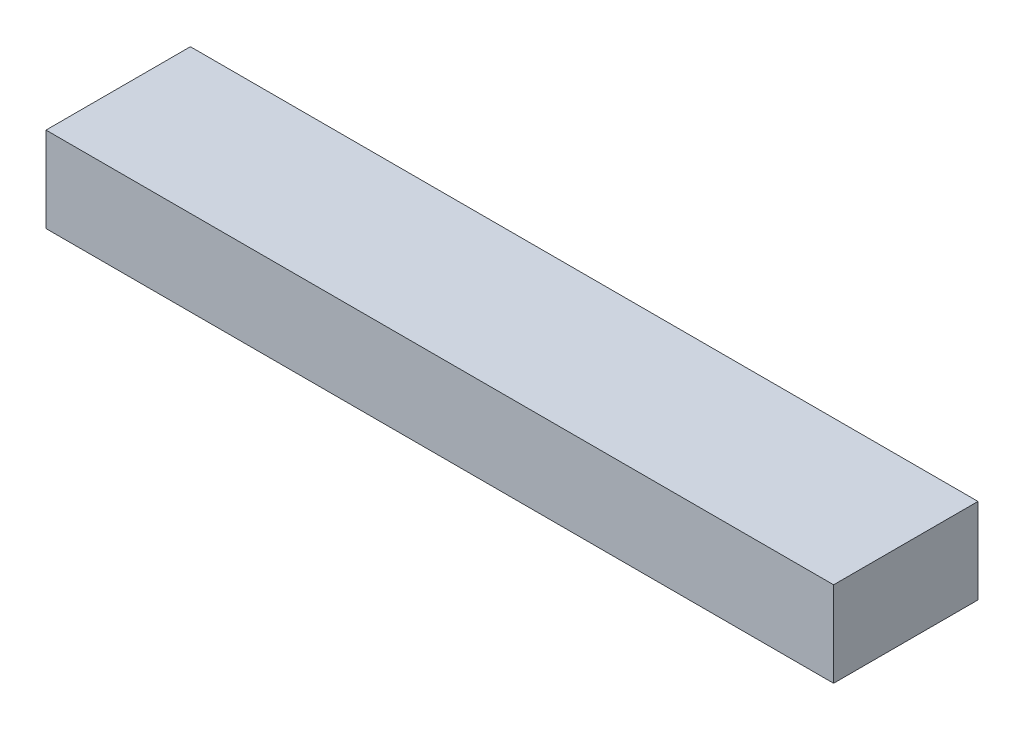
from build123d import *

# Parameters (mm, degrees)
SKETCH_1_W      = 120
SKETCH_1_H      = 22
EXTRUDE_1_DEPTH = 13


with BuildPart() as part:
    # 草图1 → 凸台-拉伸1 (new body)
    with BuildSketch(Plane(origin=(0, 0, 0), x_dir=(1, 0, 0), z_dir=(0, 1, 0))):
        with Locations((1.917525773, 22.113402062)):
            Rectangle(SKETCH_1_W, SKETCH_1_H)
    extrude(amount=EXTRUDE_1_DEPTH)


solid = part.part
